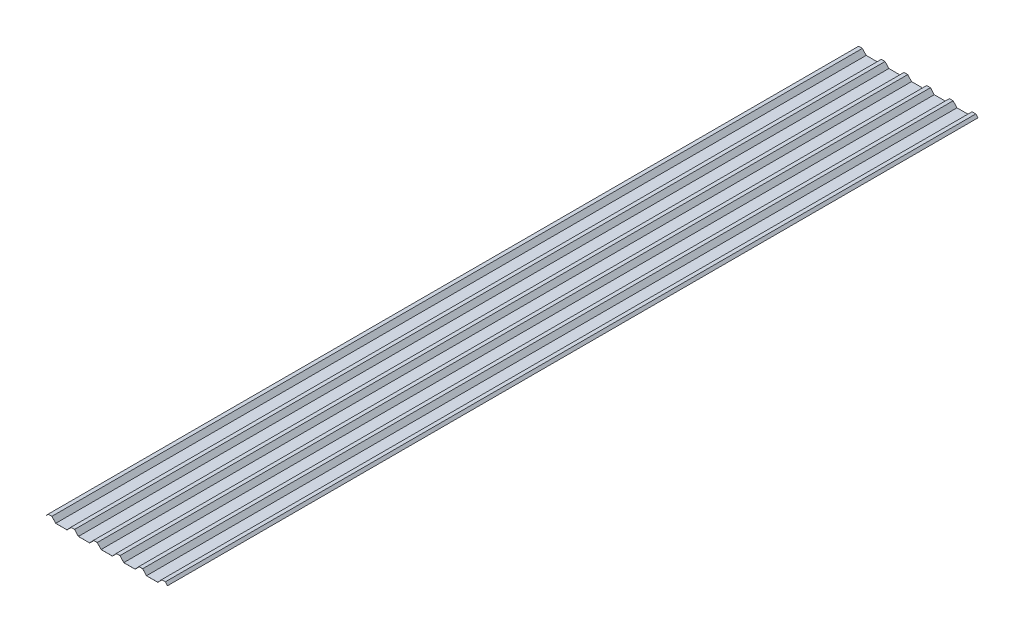
from build123d import *

# Parameters (mm, degrees)
EXTRUS_O_FINA1_DEPTH = 7000


with BuildPart() as part:
    # Esboço1 → Extrusão-Fina1 (new body)
    with BuildSketch(Plane.XY):
        Polygon((-214.272936105, -20), (-196, 0), (-164, 0), (-131, -36), (-33, -36), (0, 0), (32, 0), (65, -36), (163, -36), (196, 0), (228, 0), (261, -36), (359, -36), (392, 0), (424, 0), (457, -36), (555, -36), (588, 0), (620, 0), (653, -36), (751, -36), (784, 0), (816, 0), (834.566797067, -20), (834.933236123, -19.659820021), (816.218071761, 0.5), (783.780049142, 0.5), (750.780049142, -35.5), (653.219950858, -35.5), (620.219950858, 0.5), (587.780049142, 0.5), (554.780049142, -35.5), (457.219950858, -35.5), (424.219950858, 0.5), (391.780049142, 0.5), (358.780049142, -35.5), (261.219950858, -35.5), (228.219950858, 0.5), (195.780049142, 0.5), (162.780049142, -35.5), (65.219950858, -35.5), (32.219950858, 0.5), (-0.219950858, 0.5), (-33.219950858, -35.5), (-130.780049142, -35.5), (-163.780049142, 0.5), (-196.220441406, 0.5), (-214.642067937, -19.66274388), align=None)
    extrude(amount=EXTRUS_O_FINA1_DEPTH)


solid = part.part
